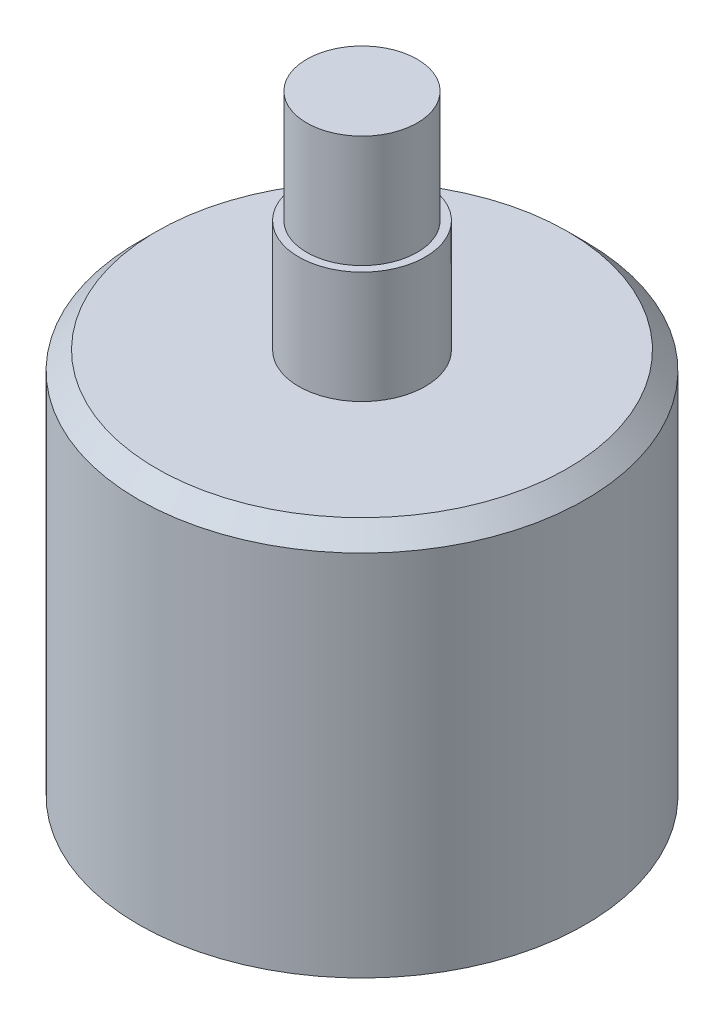
from build123d import *

# Parameters (mm, degrees)
SKETCH2_R          = 1.2573
CUT_EXTRUDE1_DEPTH = 3.175


with BuildPart() as part:
    # Sketch1 → Revolve1 (revolve)
    with BuildSketch(Plane.XY, mode=Mode.PRIVATE) as revolve1_sk:
        Polygon((0, 40.7), (3.45, 40.7), (3.45, 33.7), (3.95, 33.7), (3.95, 26.7), (12.827467985, 26.7), (13.95, 25.577467985), (13.95, 2.6), (3, 2.6), (3, 0), (0, 0), align=None)
    revolve(revolve1_sk.sketch.rotate(Axis((0, 0, 0), (0, 1, 0)), 90), axis=Axis((0, 0, 0), (0, 1, 0)))

    # Sketch2 → Cut-Extrude1 (cut)
    with BuildSketch(Plane.XZ.offset(-2.6)):
        with Locations(Location((-9.5, 0, 0), (0, 0, 270))):
            Circle(SKETCH2_R)
        with Locations(Location((0, -8, 0), (0, 0, 270))):
            Circle(SKETCH2_R)
        with Locations(Location((9.5, 0, 0), (0, 0, 270))):
            Circle(SKETCH2_R)
        with Locations(Location((0, 8, 0), (0, 0, 270))):
            Circle(SKETCH2_R)
    extrude(amount=-CUT_EXTRUDE1_DEPTH, mode=Mode.SUBTRACT)


solid = part.part
